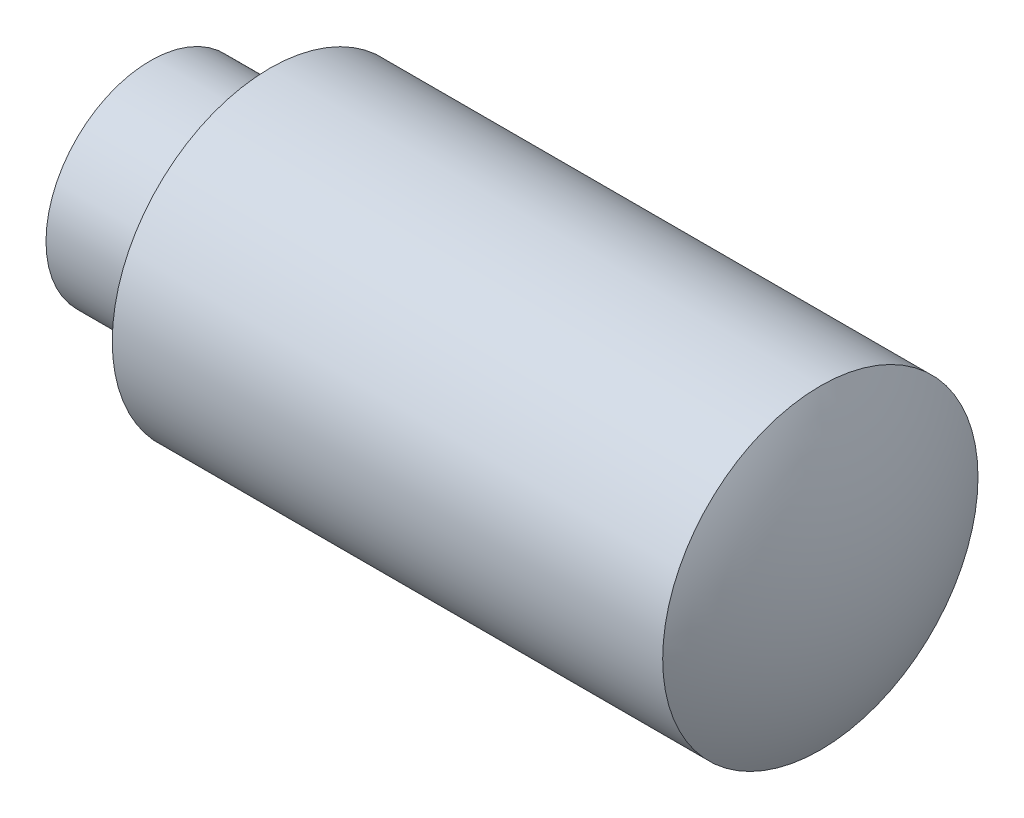
from build123d import *


with BuildPart() as part:
    # 草图2 → 旋转3 (revolve)
    with BuildSketch(Plane.XY):
        with BuildLine():
            ThreePointArc((-1.412908835, 0.692863), (-1.157300658, 0.387514536), (-1.065618, 0))
            Line((-1.065618, 0), (2.520618, 0))
            ThreePointArc((2.520618, 0), (2.449727667, 0.54166021), (2.241831865, 1.046834))
            Line((2.241831865, 1.046834), (-1.412908835, 1.046834))
            Line((-1.412908835, 1.046834), (-1.412908835, 0.692863))
        make_face()
    revolve(axis=Axis((-1.065618, 0, 0), (1, 0, 0)))

    # 草图3 → 旋转5 (revolve)
    with BuildSketch(Plane.XY, mode=Mode.PRIVATE) as revolve_5_sk:
        with BuildLine():
            Line((-2.306163, 0), (-1.065618, 0))
            ThreePointArc((-1.065618, 0), (-1.157300658, 0.387514536), (-1.412908835, 0.692863))
            Line((-1.412908835, 0.692863), (-2.206807236, 0.692863))
            Line((-2.206807236, 0.692863), (-2.206807236, 0.669619))
            ThreePointArc((-2.206807236, 0.669619), (-2.281188832, 0.338474952), (-2.306163, 0))
        make_face()
    revolve(revolve_5_sk.sketch.rotate(Axis((-2.306163, 0, 0), (1, 0, 0)), 90), axis=Axis((-2.306163, 0, 0), (1, 0, 0)))


solid = part.part
